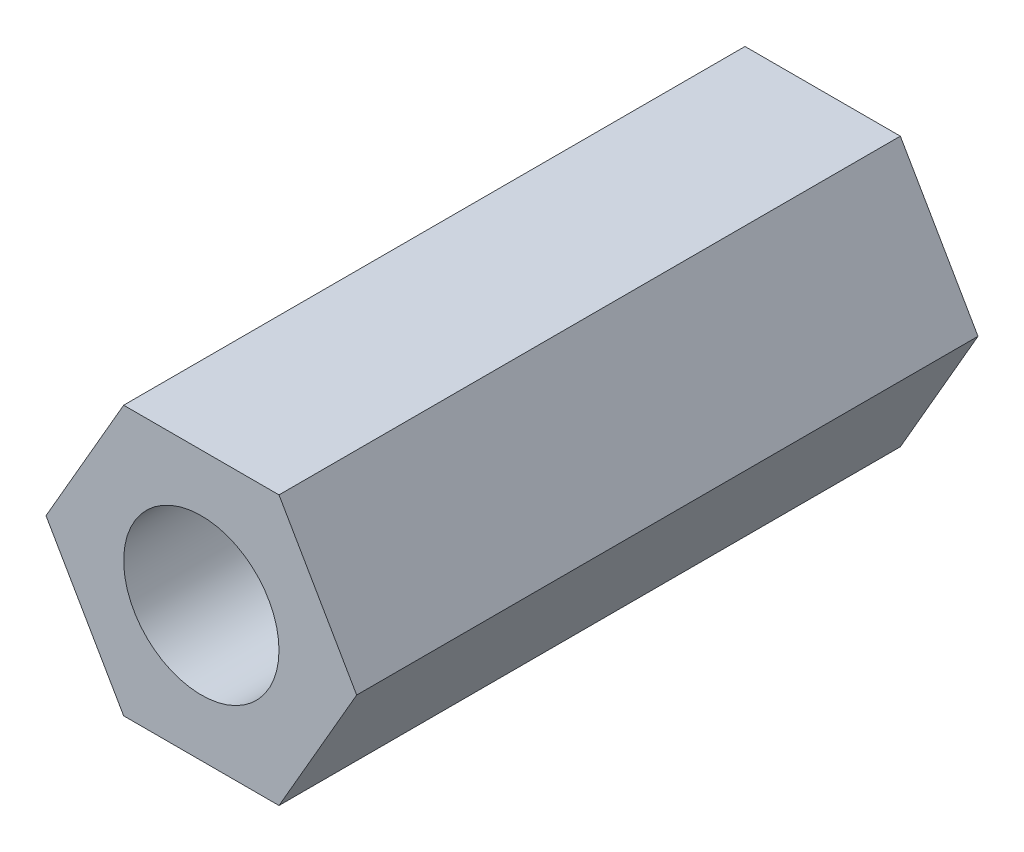
from build123d import *

# Parameters (mm, degrees)
EXTRUDE_1_DEPTH    = 10
HOLE_WIZARD_M3_1_D = 2.5


with BuildPart() as part:
    # 草图1 → 凸台-拉伸1 (new body)
    with BuildSketch(Plane.XY):
        Polygon((0, 0), (2.5, 0), (3.75, -2.165063509), (2.5, -4.330127019), (0, -4.330127019), (-1.25, -2.165063509), align=None)
    extrude(amount=EXTRUDE_1_DEPTH)

    # M3 螺纹孔1 (through all)
    with Locations(Plane.XY.offset(10)):
        with Locations((1.25, -2.165063509)):
            Hole(HOLE_WIZARD_M3_1_D / 2)


solid = part.part
